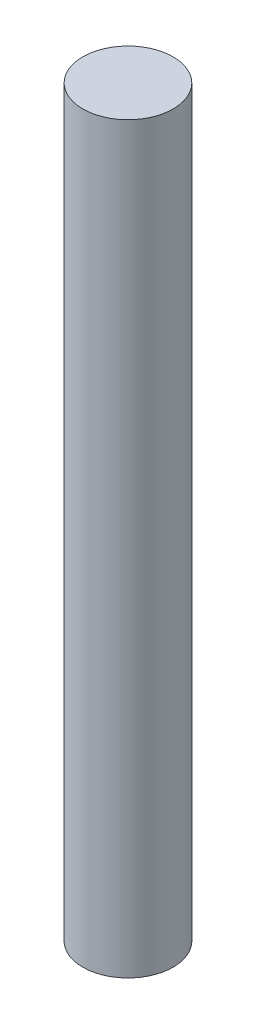
from build123d import *

# Parameters (mm, degrees)
SKETCH1_R           = 1.75
BOSS_EXTRUDE1_DEPTH = 28.8


with BuildPart() as part:
    # Sketch1 → Boss-Extrude1 (new body)
    with BuildSketch(Plane(origin=(0, 0, 0), x_dir=(1, 0, 0), z_dir=(0, 1, 0))):
        with Locations(Location((0, 0, 0), (0, 0, 270))):
            Circle(SKETCH1_R)
    extrude(amount=BOSS_EXTRUDE1_DEPTH)


solid = part.part
